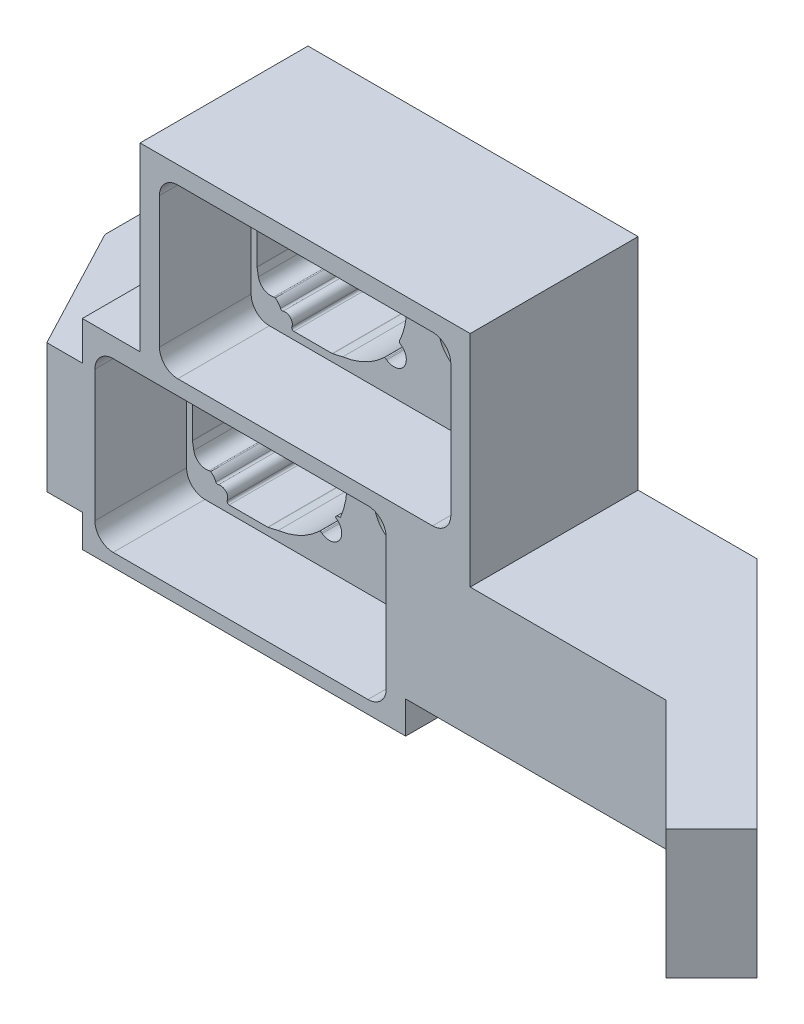
from build123d import *

# Parameters (mm, degrees)
BOSS_EXTRUDE1_DEPTH      = 25.4
BOSS_EXTRUDE2_DEPTH      = 6.35
BOSS_EXTRUDE2_DEPTH_BACK = 68.58
SKETCH6_W                = 99.695
SKETCH6_H                = 33.02
CUT_EXTRUDE2_START       = -33.02
CUT_EXTRUDE2_DEPTH       = 18.034
SKETCH3_R                = 11.1125
CUT_EXTRUDE3_DEPTH       = 7.1628
CUT_EXTRUDE4_REACH       = 178.155
CUT_EXTRUDE5_START       = -12.446
SKETCH5_4_R              = 6.113994518
CUT_EXTRUDE5_DEPTH       = 2.54
CUT_EXTRUDE6_DEPTH       = 7.1628
CUT_EXTRUDE7_REACH       = 178.155
SKETCH8_W                = 23.42
SKETCH8_H                = 43.18
SKETCH8_W_2              = 11.355
SKETCH8_H_2              = 35.57
SKETCH8_W_3              = 36.12
SKETCH8_H_3              = 6.35


with BuildPart() as part:
    # Sketch2 → Boss-Extrude1 (new body)
    with BuildSketch(Plane(origin=(0, 0, 0), x_dir=(1, 0, 0), z_dir=(0, 1, 0))):
        Polygon((152.664354058, -152.664354058), (106.68, -106.68), (6.985, -106.68), (-12.7, -107.95), (-12.7, -115.57), (0, -139.7), (121.739487758, -139.7), (143.684097937, -161.644610179), align=None)
    extrude(amount=BOSS_EXTRUDE1_DEPTH)

    # Sketch6 → Boss-Extrude2 (add, two sides: drawn at the far end of the back side and taken through both)
    with BuildSketch(Plane.XZ.offset(-BOSS_EXTRUDE2_DEPTH_BACK)):
        with Locations((56.8325, 123.19)):
            Rectangle(SKETCH6_W, SKETCH6_H)
    extrude(amount=BOSS_EXTRUDE2_DEPTH + BOSS_EXTRUDE2_DEPTH_BACK)

    # Sketch5 → Cut-Extrude2 (cut)
    with BuildSketch(Plane(origin=(0, 0, 106.68), x_dir=(-1, 0, 0), z_dir=(0, 0, -1)).offset(CUT_EXTRUDE2_START)):
        with BuildLine():
            Line((-66.75, 25.6), (-66.75, -0.2))
            ThreePointArc((-66.75, -0.2), (-65.695584412, -2.745584412), (-63.15, -3.8))
            Line((-63.15, -3.8), (-13.05, -3.8))
            ThreePointArc((-13.05, -3.8), (-10.504415588, -2.745584412), (-9.45, -0.2))
            Line((-9.45, -0.2), (-9.45, 25.6))
            ThreePointArc((-9.45, 25.6), (-10.504415588, 28.145584412), (-13.05, 29.2))
            Line((-13.05, 29.2), (-63.15, 29.2))
            ThreePointArc((-63.15, 29.2), (-65.695584412, 28.145584412), (-66.75, 25.6))
        make_face()
        with BuildLine():
            Line((-79.45, 61.521024484), (-79.45, 35.721024484))
            ThreePointArc((-79.45, 35.721024484), (-78.395584412, 33.175440072), (-75.85, 32.121024484))
            Line((-75.85, 32.121024484), (-25.75, 32.121024484))
            ThreePointArc((-25.75, 32.121024484), (-23.204415588, 33.175440072), (-22.15, 35.721024484))
            Line((-22.15, 35.721024484), (-22.15, 61.521024484))
            ThreePointArc((-22.15, 61.521024484), (-23.204415588, 64.066608897), (-25.75, 65.121024484))
            Line((-25.75, 65.121024484), (-75.85, 65.121024484))
            ThreePointArc((-75.85, 65.121024484), (-78.395584412, 64.066608897), (-79.45, 61.521024484))
        make_face()
    extrude(amount=CUT_EXTRUDE2_DEPTH, mode=Mode.SUBTRACT)

    # Sketch3 → Cut-Extrude3 (cut)
    with BuildSketch(Plane(origin=(0, 0, 106.68), x_dir=(-1, 0, 0), z_dir=(0, 0, -1))):
        with Locations((0, 12.7)):
            Circle(SKETCH3_R)
    extrude(amount=-CUT_EXTRUDE3_DEPTH, mode=Mode.SUBTRACT)

    # Sketch5<3> → Cut-Extrude4 (cut, up to next)
    with BuildSketch(Plane(origin=(0, 0, 106.68), x_dir=(-1, 0, 0), z_dir=(0, 0, -1)), mode=Mode.PRIVATE) as cut_extrude4_sk1:
        with BuildLine():
            ThreePointArc((-17.454544234, 27.201392579), (-17.161089301, 25.735153586), (-15.710183504, 25.37342862))
            add(Edge.make_bspline(
                [(-15.214362493, 25.145843703), (-15.252740591, 25.239203063), (-15.326706684, 25.315665227), (-15.50838897, 25.398999551), (-15.614372286, 25.405194234), (-15.710183504, 25.37342862)],
                knots=[0, 0, 0, 0, 0.000301952, 0.000301952, 0.000603904, 0.000603904, 0.000603904, 0.000603904], degree=3, weights=[1, 1, 1, 1, 1, 1]))
            ThreePointArc((-15.214362493, 25.145843703), (-14.792159607, 24.439786176), (-14.181363394, 23.888695899))
            add(Edge.make_bspline(
                [(-13.93307766, 23.850380907), (-14.016819693, 23.826397587), (-14.108747024, 23.840583645), (-14.181363394, 23.888695899)],
                knots=[0, 0, 0, 0, 0.000257617, 0.000257617, 0.000257617, 0.000257617], degree=3, weights=[1, 1, 1, 1]))
            ThreePointArc((-13.93307766, 23.850380907), (-11.978075507, 23.575139467), (-10.874203161, 21.938295824))
            Line((-10.874203161, 21.938295824), (-10.611201717, 20.446740514))
            ThreePointArc((-10.611201717, 20.446740514), (-10.606647112, 20.412144857), (-10.60512505, 20.377283888))
            Line((-10.60512505, 20.377283888), (-10.60512505, 5.022716112))
            ThreePointArc((-10.60512505, 5.022716112), (-10.606647112, 4.987855143), (-10.611201717, 4.953259486))
            Line((-10.611201717, 4.953259486), (-10.874203161, 3.461704176))
            ThreePointArc((-10.874203161, 3.461704176), (-11.978075507, 1.824860533), (-13.93307766, 1.549619093))
            add(Edge.make_bspline(
                [(-14.181363394, 1.511304101), (-14.108747016, 1.55941636), (-14.016819684, 1.573602411), (-13.93307766, 1.549619093)],
                knots=[0, 0, 0, 0, 0.000257617, 0.000257617, 0.000257617, 0.000257617], degree=3, weights=[1, 1, 1, 1]))
            ThreePointArc((-14.181363394, 1.511304101), (-14.792159607, 0.960213824), (-15.214362493, 0.254156297))
            add(Edge.make_bspline(
                [(-15.710183504, 0.02657138), (-15.614372263, -0.005194241), (-15.508171677, 0.001041216), (-15.326534106, 0.084472958), (-15.252740582, 0.16079696), (-15.214362493, 0.254156297)],
                knots=[0, 0, 0, 0, 0.000301952, 0.000301952, 0.000603904, 0.000603904, 0.000603904, 0.000603904], degree=3, weights=[1, 1, 1, 1, 1, 1]))
            ThreePointArc((-15.710183504, 0.02657138), (-17.161089301, -0.335153586), (-17.454544234, -1.801392579))
            add(Edge.make_bspline(
                [(-17.827902311, -2.34487495), (-17.697556499, -2.34487495), (-17.571268418, -2.277913043), (-17.424786106, -2.064315845), (-17.407781693, -1.923061319), (-17.454544234, -1.801392579)],
                knots=[0, 0, 0, 0, 0.000387965, 0.000387965, 0.00077593, 0.00077593, 0.00077593, 0.00077593], degree=3, weights=[1, 1, 1, 1, 1, 1]))
            Line((-17.827902311, -2.34487495), (-25.391814589, -2.34487495))
            ThreePointArc((-25.391814589, -2.34487495), (-25.436649043, -2.342354252), (-25.480918405, -2.334823926))
            Line((-25.480918405, -2.334823926), (-27.45939141, -1.882722774))
            ThreePointArc((-27.45939141, -1.882722774), (-31.807672398, -0.560415941), (-35.545722635, 2.024738472))
            add(Edge.make_bspline(
                [(-35.92871369, 2.049985751), (-35.871983492, 2.091202652), (-35.802580884, 2.111197617), (-35.663081434, 2.102085507), (-35.596551285, 2.073045802), (-35.545722635, 2.024738472)],
                knots=[0, 0, 0, 0, 0.000207381, 0.000207381, 0.000414763, 0.000414763, 0.000414763, 0.000414763], degree=3, weights=[1, 1, 1, 1, 1, 1]))
            Line((-35.92871369, 2.049985751), (-36.108453306, 1.919397276))
            ThreePointArc((-36.108453306, 1.919397276), (-39.499078855, 2.456419606), (-38.962056525, 5.847045155))
            Line((-38.962056525, 5.847045155), (-38.700039494, 6.037411672))
            add(Edge.make_bspline(
                [(-39.671321079, 6.40912486), (-39.491482985, 6.470326051), (-39.295863933, 6.466518129), (-38.942049513, 6.33134656), (-38.793068952, 6.20304034), (-38.700039494, 6.037411672)],
                knots=[0, 0, 0, 0, 0.000207192, 0.000207192, 0.000414384, 0.000414384, 0.000414384, 0.000414384], degree=3, weights=[1, 1, 1, 1, 1, 1]))
            ThreePointArc((-39.671321079, 6.40912486), (-40.996336601, 12.7), (-39.671321079, 18.99087514))
            add(Edge.make_bspline(
                [(-38.700039494, 19.362588328), (-38.793068939, 19.196959683), (-38.941249019, 19.069194359), (-39.294906836, 18.933613589), (-39.49148296, 18.92967394), (-39.671321079, 18.99087514)],
                knots=[0, 0, 0, 0, 0.000207192, 0.000207192, 0.000414384, 0.000414384, 0.000414384, 0.000414384], degree=3, weights=[1, 1, 1, 1, 1, 1]))
            Line((-38.700039494, 19.362588328), (-38.962056525, 19.552954845))
            ThreePointArc((-38.962056525, 19.552954845), (-39.499078855, 22.943580394), (-36.108453306, 23.480602724))
            Line((-36.108453306, 23.480602724), (-35.92871369, 23.350014249))
            add(Edge.make_bspline(
                [(-35.545722635, 23.375261528), (-35.596551277, 23.326954205), (-35.662728517, 23.298021636), (-35.802216956, 23.288742494), (-35.871983484, 23.308797342), (-35.92871369, 23.350014249)],
                knots=[0, 0, 0, 0, 0.000207381, 0.000207381, 0.000414763, 0.000414763, 0.000414763, 0.000414763], degree=3, weights=[1, 1, 1, 1, 1, 1]))
            ThreePointArc((-35.545722635, 23.375261528), (-31.807672398, 25.960415941), (-27.45939141, 27.282722774))
            Line((-27.45939141, 27.282722774), (-25.480918405, 27.734823926))
            ThreePointArc((-25.480918405, 27.734823926), (-25.436649043, 27.742354252), (-25.391814589, 27.74487495))
            Line((-25.391814589, 27.74487495), (-17.827902311, 27.74487495))
            add(Edge.make_bspline(
                [(-17.454544234, 27.201392579), (-17.407781675, 27.323061366), (-17.42497916, 27.46496564), (-17.571805697, 27.678326365), (-17.697556549, 27.74487495), (-17.827902311, 27.74487495)],
                knots=[0, 0, 0, 0, 0.000387965, 0.000387965, 0.00077593, 0.00077593, 0.00077593, 0.00077593], degree=3, weights=[1, 1, 1, 1, 1, 1]))
        make_face()
    cut_extrude4_tool1 = extrude(cut_extrude4_sk1.sketch, amount=-CUT_EXTRUDE4_REACH, mode=Mode.PRIVATE) & part.part
    # Sketch5<3> → Cut-Extrude4 (cut, up to next)
    with BuildSketch(Plane(origin=(0, 0, 106.68), x_dir=(-1, 0, 0), z_dir=(0, 0, -1)), mode=Mode.PRIVATE) as cut_extrude4_sk2:
        with BuildLine():
            add(Edge.make_bspline(
                [(-60.481955136, 45.780504886), (-60.43603869, 45.830492059), (-60.342768327, 45.932031316), (-60.210512218, 46.095686675), (-60.082424784, 46.270790705), (-59.960384175, 46.458160464), (-59.845452755, 46.657637292), (-59.738984645, 46.869213959), (-59.621767894, 47.140289076), (-59.508614587, 47.470465843), (-59.417629172, 47.856630085), (-59.362280095, 48.240348368), (-59.355545496, 48.495193602), (-59.35222026, 48.621024484)],
                knots=[0, 0, 0, 0, 0.065342869, 0.132731377, 0.202172121, 0.273671089, 0.34723372, 0.422864961, 0.500569311, 0.630039386, 0.756419003, 0.879730881, 1, 1, 1, 1], degree=3))
            add(Edge.make_bspline(
                [(-59.35222026, 48.621024484), (-59.353041537, 48.683605666), (-59.354694528, 48.809563278), (-59.368182489, 48.999289729), (-59.390076129, 49.190570817), (-59.421452131, 49.382952948), (-59.462353225, 49.575954803), (-59.513076509, 49.769063285), (-59.573817711, 49.961751282), (-59.66958434, 50.22044963), (-59.812379165, 50.532057472), (-60.01548274, 50.878047648), (-60.236777354, 51.188660597), (-60.401680377, 51.372198075), (-60.481955136, 51.461544083)],
                knots=[0, 0, 0, 0, 0.059829934, 0.120420154, 0.181774032, 0.243894787, 0.306785488, 0.370449065, 0.434888311, 0.500105888, 0.634537507, 0.762645389, 0.884455823, 1, 1, 1, 1], degree=3))
            add(Edge.make_bspline(
                [(-60.481955136, 51.461544083), (-60.530159757, 51.511097927), (-60.62469657, 51.608280778), (-60.772553471, 51.74244675), (-60.919998795, 51.864970253), (-61.066676585, 51.975832923), (-61.256721871, 52.107106274), (-61.493288336, 52.249506944), (-61.777918239, 52.393732819), (-61.971154552, 52.469744688), (-62.065454672, 52.506838795)],
                knots=[0, 0, 0, 0, 0.108779889, 0.213334401, 0.313672693, 0.409804769, 0.501741655, 0.675682941, 0.841731935, 1, 1, 1, 1], degree=3))
            ThreePointArc((-62.065454672, 52.506838795), (-67.642158031, 48.621024484), (-62.065454672, 44.735210174))
            add(Edge.make_bspline(
                [(-62.065454672, 44.735210174), (-62.008979836, 44.756870749), (-61.894345595, 44.800838005), (-61.723848207, 44.877399324), (-61.551983288, 44.963484129), (-61.379725849, 45.060307764), (-61.182854283, 45.183635126), (-60.961270581, 45.342187281), (-60.715668653, 45.544576476), (-60.561593799, 45.70011149), (-60.481955136, 45.780504886)],
                knots=[0, 0, 0, 0, 0.094498647, 0.191816063, 0.291978629, 0.395010761, 0.500935114, 0.655694233, 0.822034222, 1, 1, 1, 1], degree=3))
        make_face()
    cut_extrude4_tool2 = extrude(cut_extrude4_sk2.sketch, amount=-CUT_EXTRUDE4_REACH, mode=Mode.PRIVATE) & part.part
    # Sketch5<3> → Cut-Extrude4 (cut, up to next)
    with BuildSketch(Plane(origin=(0, 0, 106.68), x_dir=(-1, 0, 0), z_dir=(0, 0, -1)), mode=Mode.PRIVATE) as cut_extrude4_sk3:
        with BuildLine():
            ThreePointArc((-30.154544234, 63.122417063), (-29.861089301, 61.65617807), (-28.410183504, 61.294453104))
            add(Edge.make_bspline(
                [(-27.914362493, 61.066868187), (-27.952740591, 61.160227547), (-28.026706684, 61.236689711), (-28.20838897, 61.320024036), (-28.314372286, 61.326218718), (-28.410183504, 61.294453104)],
                knots=[0, 0, 0, 0, 0.000301952, 0.000301952, 0.000603904, 0.000603904, 0.000603904, 0.000603904], degree=3, weights=[1, 1, 1, 1, 1, 1]))
            ThreePointArc((-27.914362493, 61.066868187), (-27.492159607, 60.36081066), (-26.881363394, 59.809720383))
            add(Edge.make_bspline(
                [(-26.63307766, 59.771405392), (-26.716819693, 59.747422071), (-26.808747024, 59.761608129), (-26.881363394, 59.809720383)],
                knots=[0, 0, 0, 0, 0.000257617, 0.000257617, 0.000257617, 0.000257617], degree=3, weights=[1, 1, 1, 1]))
            ThreePointArc((-26.63307766, 59.771405392), (-24.678075507, 59.496163951), (-23.574203161, 57.859320308))
            Line((-23.574203161, 57.859320308), (-23.311201717, 56.367764998))
            ThreePointArc((-23.311201717, 56.367764998), (-23.306647112, 56.333169342), (-23.30512505, 56.298308372))
            Line((-23.30512505, 56.298308372), (-23.30512505, 40.943740596))
            ThreePointArc((-23.30512505, 40.943740596), (-23.306647112, 40.908879627), (-23.311201717, 40.87428397))
            Line((-23.311201717, 40.87428397), (-23.574203161, 39.38272866))
            ThreePointArc((-23.574203161, 39.38272866), (-24.678075507, 37.745885017), (-26.63307766, 37.470643577))
            add(Edge.make_bspline(
                [(-26.881363394, 37.432328586), (-26.808747016, 37.480440845), (-26.716819684, 37.494626895), (-26.63307766, 37.470643577)],
                knots=[0, 0, 0, 0, 0.000257617, 0.000257617, 0.000257617, 0.000257617], degree=3, weights=[1, 1, 1, 1]))
            ThreePointArc((-26.881363394, 37.432328586), (-27.492159607, 36.881238309), (-27.914362493, 36.175180781))
            add(Edge.make_bspline(
                [(-28.410183504, 35.947595864), (-28.314372263, 35.915830243), (-28.208171677, 35.922065701), (-28.026534106, 36.005497443), (-27.952740582, 36.081821444), (-27.914362493, 36.175180781)],
                knots=[0, 0, 0, 0, 0.000301952, 0.000301952, 0.000603904, 0.000603904, 0.000603904, 0.000603904], degree=3, weights=[1, 1, 1, 1, 1, 1]))
            ThreePointArc((-28.410183504, 35.947595864), (-29.861089301, 35.585870898), (-30.154544234, 34.119631905))
            add(Edge.make_bspline(
                [(-30.527902311, 33.576149534), (-30.397556499, 33.576149534), (-30.271268418, 33.643111441), (-30.124786106, 33.856708639), (-30.107781693, 33.997963165), (-30.154544234, 34.119631905)],
                knots=[0, 0, 0, 0, 0.000387965, 0.000387965, 0.00077593, 0.00077593, 0.00077593, 0.00077593], degree=3, weights=[1, 1, 1, 1, 1, 1]))
            Line((-30.527902311, 33.576149534), (-38.091814589, 33.576149534))
            ThreePointArc((-38.091814589, 33.576149534), (-38.136649043, 33.578670232), (-38.180918405, 33.586200558))
            Line((-38.180918405, 33.586200558), (-40.15939141, 34.03830171))
            ThreePointArc((-40.15939141, 34.03830171), (-44.507672398, 35.360608544), (-48.245722635, 37.945762956))
            add(Edge.make_bspline(
                [(-48.62871369, 37.971010235), (-48.571983492, 38.012227136), (-48.502580884, 38.032222102), (-48.363081434, 38.023109992), (-48.296551285, 37.994070286), (-48.245722635, 37.945762956)],
                knots=[0, 0, 0, 0, 0.000207381, 0.000207381, 0.000414763, 0.000414763, 0.000414763, 0.000414763], degree=3, weights=[1, 1, 1, 1, 1, 1]))
            Line((-48.62871369, 37.971010235), (-48.808453306, 37.84042176))
            ThreePointArc((-48.808453306, 37.84042176), (-52.199078855, 38.37744409), (-51.662056525, 41.76806964))
            Line((-51.662056525, 41.76806964), (-51.400039494, 41.958436156))
            add(Edge.make_bspline(
                [(-51.305540598, 42.330149344), (-51.275410324, 42.26690114), (-51.268415461, 42.195084423), (-51.302753207, 42.059688347), (-51.343361112, 41.999615411), (-51.400039494, 41.958436156)],
                knots=[0, 0, 0, 0, 0.000207192, 0.000207192, 0.000414384, 0.000414384, 0.000414384, 0.000414384], degree=3, weights=[1, 1, 1, 1, 1, 1]))
            ThreePointArc((-51.305540598, 42.330149344), (-52.727419885, 48.621024484), (-51.305540598, 54.911899624))
            add(Edge.make_bspline(
                [(-51.400039494, 55.283612813), (-51.343361119, 55.242433563), (-51.302917009, 55.182677033), (-51.268422661, 55.04732077), (-51.275410319, 54.975147837), (-51.305540598, 54.911899624)],
                knots=[0, 0, 0, 0, 0.000207192, 0.000207192, 0.000414384, 0.000414384, 0.000414384, 0.000414384], degree=3, weights=[1, 1, 1, 1, 1, 1]))
            Line((-51.400039494, 55.283612813), (-51.662056525, 55.473979329))
            ThreePointArc((-51.662056525, 55.473979329), (-52.199078855, 58.864604878), (-48.808453306, 59.401627208))
            Line((-48.808453306, 59.401627208), (-48.62871369, 59.271038734))
            add(Edge.make_bspline(
                [(-48.245722635, 59.296286012), (-48.296551277, 59.24797869), (-48.362728517, 59.21904612), (-48.502216956, 59.209766979), (-48.571983484, 59.229821826), (-48.62871369, 59.271038734)],
                knots=[0, 0, 0, 0, 0.000207381, 0.000207381, 0.000414763, 0.000414763, 0.000414763, 0.000414763], degree=3, weights=[1, 1, 1, 1, 1, 1]))
            ThreePointArc((-48.245722635, 59.296286012), (-44.507672398, 61.881440425), (-40.15939141, 63.203747258))
            Line((-40.15939141, 63.203747258), (-38.180918405, 63.65584841))
            ThreePointArc((-38.180918405, 63.65584841), (-38.136649043, 63.663378736), (-38.091814589, 63.665899435))
            Line((-38.091814589, 63.665899435), (-30.527902311, 63.665899435))
            add(Edge.make_bspline(
                [(-30.154544234, 63.122417063), (-30.107781675, 63.24408585), (-30.12497916, 63.385990124), (-30.271805697, 63.599350849), (-30.397556549, 63.665899435), (-30.527902311, 63.665899435)],
                knots=[0, 0, 0, 0, 0.000387965, 0.000387965, 0.00077593, 0.00077593, 0.00077593, 0.00077593], degree=3, weights=[1, 1, 1, 1, 1, 1]))
        make_face()
    cut_extrude4_tool3 = extrude(cut_extrude4_sk3.sketch, amount=-CUT_EXTRUDE4_REACH, mode=Mode.PRIVATE) & part.part
    # Sketch5<3> → Cut-Extrude4 (cut, up to next)
    with BuildSketch(Plane(origin=(0, 0, 106.68), x_dir=(-1, 0, 0), z_dir=(0, 0, -1)), mode=Mode.PRIVATE) as cut_extrude4_sk4:
        with BuildLine():
            ThreePointArc((-49.365454672, 16.58581431), (-54.942158031, 12.7), (-49.365454672, 8.81418569))
            add(Edge.make_bspline(
                [(-49.365454672, 8.81418569), (-49.308979836, 8.835846265), (-49.194345595, 8.879813521), (-49.023848207, 8.95637484), (-48.851983288, 9.042459645), (-48.679725849, 9.13928328), (-48.482854283, 9.262610642), (-48.261270581, 9.421162797), (-48.015668653, 9.623551991), (-47.861593799, 9.779087006), (-47.781955136, 9.859480401)],
                knots=[0, 0, 0, 0, 0.094498647, 0.191816063, 0.291978629, 0.395010761, 0.500935114, 0.655694233, 0.822034222, 1, 1, 1, 1], degree=3))
            add(Edge.make_bspline(
                [(-47.781955136, 9.859480401), (-47.73603869, 9.909467575), (-47.642768327, 10.011006832), (-47.510512218, 10.174662191), (-47.382424784, 10.34976622), (-47.260384175, 10.53713598), (-47.145452755, 10.736612808), (-47.038984645, 10.948189474), (-46.921767894, 11.219264592), (-46.808614587, 11.549441358), (-46.717629172, 11.935605601), (-46.662280095, 12.319323884), (-46.655545496, 12.574169118), (-46.65222026, 12.7)],
                knots=[0, 0, 0, 0, 0.065342869, 0.132731377, 0.202172121, 0.273671089, 0.34723372, 0.422864961, 0.500569311, 0.630039386, 0.756419003, 0.879730881, 1, 1, 1, 1], degree=3))
            add(Edge.make_bspline(
                [(-46.65222026, 12.7), (-46.653041537, 12.762581182), (-46.654694528, 12.888538793), (-46.668182489, 13.078265245), (-46.690076129, 13.269546333), (-46.721452131, 13.461928463), (-46.762353225, 13.654930319), (-46.813076509, 13.848038801), (-46.873817711, 14.040726798), (-46.96958434, 14.299425146), (-47.112379165, 14.611032988), (-47.31548274, 14.957023164), (-47.536777354, 15.267636113), (-47.701680377, 15.451173591), (-47.781955136, 15.540519599)],
                knots=[0, 0, 0, 0, 0.059829934, 0.120420154, 0.181774032, 0.243894787, 0.306785488, 0.370449065, 0.434888311, 0.500105888, 0.634537507, 0.762645389, 0.884455823, 1, 1, 1, 1], degree=3))
            add(Edge.make_bspline(
                [(-47.781955136, 15.540519599), (-47.830159757, 15.590073443), (-47.92469657, 15.687256294), (-48.072553471, 15.821422265), (-48.219998795, 15.943945769), (-48.366676585, 16.054808438), (-48.556721871, 16.18608179), (-48.793288336, 16.32848246), (-49.077918239, 16.472708334), (-49.271154552, 16.548720204), (-49.365454672, 16.58581431)],
                knots=[0, 0, 0, 0, 0.108779889, 0.213334401, 0.313672693, 0.409804769, 0.501741655, 0.675682941, 0.841731935, 1, 1, 1, 1], degree=3))
        make_face()
    cut_extrude4_tool4 = extrude(cut_extrude4_sk4.sketch, amount=-CUT_EXTRUDE4_REACH, mode=Mode.PRIVATE) & part.part
    add(cut_extrude4_tool1.solids().sort_by_distance((25.222191, 12.699997, 106.68))[0], mode=Mode.SUBTRACT)
    add(cut_extrude4_tool2.solids().sort_by_distance((63.497895, 48.621015, 106.68))[0], mode=Mode.SUBTRACT)
    add(cut_extrude4_tool3.solids().sort_by_distance((37.673429, 48.621023, 106.68))[0], mode=Mode.SUBTRACT)
    add(cut_extrude4_tool4.solids().sort_by_distance((50.797895, 12.69999, 106.68))[0], mode=Mode.SUBTRACT)

    # Sketch5<4> → Cut-Extrude5 (cut)
    # profile 1 of 2: a face of its own
    with BuildSketch(Plane(origin=(0, 0, 106.68), x_dir=(-1, 0, 0), z_dir=(0, 0, -1)).offset(CUT_EXTRUDE5_START)):
        with Locations((-52.4, 12.7)):
            Circle(SKETCH5_4_R)
        with BuildLine():
            add(Edge.make_bspline(
                [(-46.65222026, 12.7), (-46.653041537, 12.762581182), (-46.654694528, 12.888538793), (-46.668182489, 13.078265245), (-46.690076129, 13.269546333), (-46.721452131, 13.461928463), (-46.762353225, 13.654930319), (-46.813076509, 13.848038801), (-46.873817711, 14.040726798), (-46.96958434, 14.299425146), (-47.112379165, 14.611032988), (-47.31548274, 14.957023164), (-47.536777354, 15.267636113), (-47.701680377, 15.451173591), (-47.781955136, 15.540519599)],
                knots=[0, 0, 0, 0, 0.059829934, 0.120420154, 0.181774032, 0.243894787, 0.306785488, 0.370449065, 0.434888311, 0.500105888, 0.634537507, 0.762645389, 0.884455823, 1, 1, 1, 1], degree=3))
            add(Edge.make_bspline(
                [(-47.781955136, 15.540519599), (-47.830159757, 15.590073443), (-47.92469657, 15.687256294), (-48.072553471, 15.821422265), (-48.219998795, 15.943945769), (-48.366676585, 16.054808438), (-48.556721871, 16.18608179), (-48.793288336, 16.32848246), (-49.077918239, 16.472708334), (-49.271154552, 16.548720204), (-49.365454672, 16.58581431)],
                knots=[0, 0, 0, 0, 0.108779889, 0.213334401, 0.313672693, 0.409804769, 0.501741655, 0.675682941, 0.841731935, 1, 1, 1, 1], degree=3))
            ThreePointArc((-49.365454672, 16.58581431), (-54.942158031, 12.7), (-49.365454672, 8.81418569))
            add(Edge.make_bspline(
                [(-49.365454672, 8.81418569), (-49.308979836, 8.835846265), (-49.194345595, 8.879813521), (-49.023848207, 8.95637484), (-48.851983288, 9.042459645), (-48.679725849, 9.13928328), (-48.482854283, 9.262610642), (-48.261270581, 9.421162797), (-48.015668653, 9.623551991), (-47.861593799, 9.779087006), (-47.781955136, 9.859480401)],
                knots=[0, 0, 0, 0, 0.094498647, 0.191816063, 0.291978629, 0.395010761, 0.500935114, 0.655694233, 0.822034222, 1, 1, 1, 1], degree=3))
            add(Edge.make_bspline(
                [(-47.781955136, 9.859480401), (-47.73603869, 9.909467575), (-47.642768327, 10.011006832), (-47.510512218, 10.174662191), (-47.382424784, 10.34976622), (-47.260384175, 10.53713598), (-47.145452755, 10.736612808), (-47.038984645, 10.948189474), (-46.921767894, 11.219264592), (-46.808614587, 11.549441358), (-46.717629172, 11.935605601), (-46.662280095, 12.319323884), (-46.655545496, 12.574169118), (-46.65222026, 12.7)],
                knots=[0, 0, 0, 0, 0.065342869, 0.132731377, 0.202172121, 0.273671089, 0.34723372, 0.422864961, 0.500569311, 0.630039386, 0.756419003, 0.879730881, 1, 1, 1, 1], degree=3))
        make_face(mode=Mode.SUBTRACT)
    # profile 2 of 2: a face of its own
    with BuildSketch(Plane(origin=(0, 0, 106.68), x_dir=(-1, 0, 0), z_dir=(0, 0, -1)).offset(CUT_EXTRUDE5_START)):
        with Locations((-65.1, 48.621024484)):
            Circle(SKETCH5_4_R)
    extrude(amount=-CUT_EXTRUDE5_DEPTH, mode=Mode.SUBTRACT)

    # Sketch7 → Cut-Extrude6 (cut)
    with BuildSketch(Plane(origin=(0, 0, 106.68), x_dir=(-1, 0, 0), z_dir=(0, 0, -1))):
        Polygon((-6.985, 21.342767569), (-10.60512505, 20.377283888), (-10.60512505, 16.019484739), align=None)
        Polygon((-6.985, 4.057232431), (-10.611201717, 4.953259486), (-10.60512505, 9.380515261), align=None)
    extrude(amount=-CUT_EXTRUDE6_DEPTH, mode=Mode.SUBTRACT)

    # Sketch8 → Cut-Extrude7 (cut, up to next)
    with BuildSketch(Plane(origin=(0, 0, 106.68), x_dir=(-1, 0, 0), z_dir=(0, 0, -1)), mode=Mode.PRIVATE) as cut_extrude7_sk1:
        with Locations((-94.97, 46.99)):
            Rectangle(SKETCH8_W, SKETCH8_H)
    cut_extrude7_tool1 = extrude(cut_extrude7_sk1.sketch, amount=-CUT_EXTRUDE7_REACH, mode=Mode.PRIVATE) & part.part
    # Sketch8 → Cut-Extrude7 (cut, up to next)
    with BuildSketch(Plane(origin=(0, 0, 106.68), x_dir=(-1, 0, 0), z_dir=(0, 0, -1)), mode=Mode.PRIVATE) as cut_extrude7_sk2:
        with Locations((-12.6625, 50.795)):
            Rectangle(SKETCH8_W_2, SKETCH8_H_2)
    cut_extrude7_tool2 = extrude(cut_extrude7_sk2.sketch, amount=-CUT_EXTRUDE7_REACH, mode=Mode.PRIVATE) & part.part
    # Sketch8 → Cut-Extrude7 (cut, up to next)
    with BuildSketch(Plane(origin=(0, 0, 106.68), x_dir=(-1, 0, 0), z_dir=(0, 0, -1)), mode=Mode.PRIVATE) as cut_extrude7_sk3:
        with Locations((-88.62, -3.175)):
            Rectangle(SKETCH8_W_3, SKETCH8_H_3)
    cut_extrude7_tool3 = extrude(cut_extrude7_sk3.sketch, amount=-CUT_EXTRUDE7_REACH, mode=Mode.PRIVATE) & part.part
    add(cut_extrude7_tool1.solids().sort_by_distance((94.97, 46.99, 106.68))[0], mode=Mode.SUBTRACT)
    add(cut_extrude7_tool2.solids().sort_by_distance((12.6625, 50.795, 106.68))[0], mode=Mode.SUBTRACT)
    add(cut_extrude7_tool3.solids().sort_by_distance((88.62, -3.175, 106.68))[0], mode=Mode.SUBTRACT)


solid = part.part
